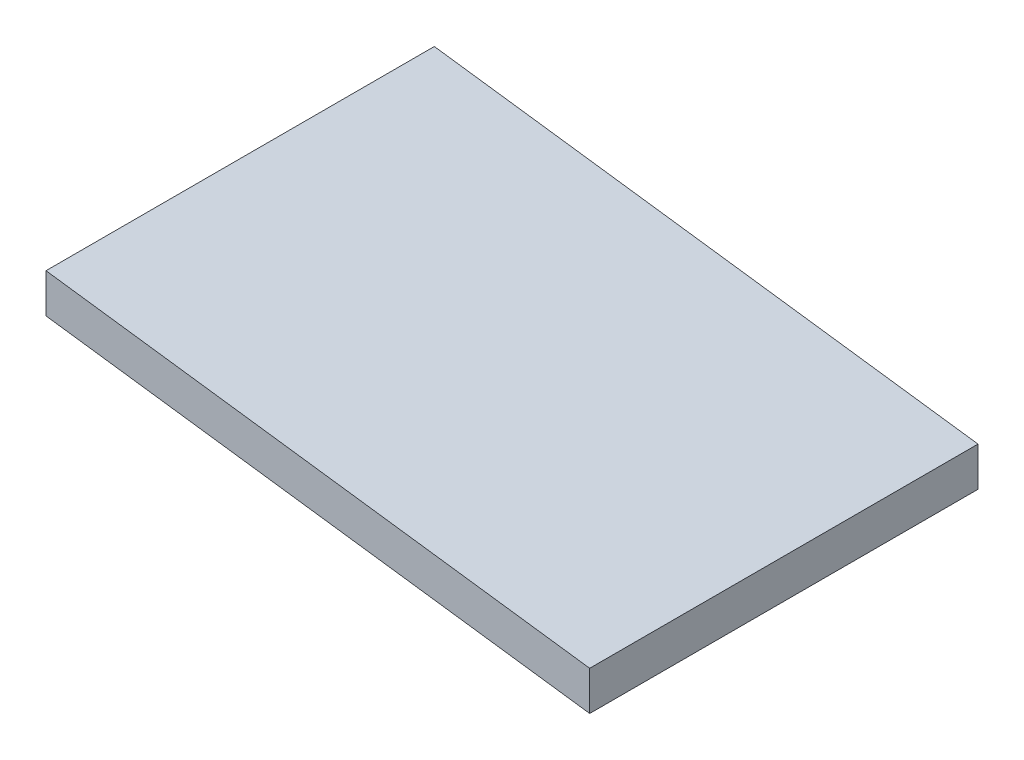
from build123d import *

# Parameters (mm, degrees)
BOSS_EXTRUDE1_DEPTH = 100


with BuildPart() as part:
    # Sketch1 → Boss-Extrude1 (new body)
    with BuildSketch(Plane.XY):
        Polygon((0, 0), (140, -18.666666667), (140, -28.755163967), (0, -10.0884973), align=None)
    extrude(amount=BOSS_EXTRUDE1_DEPTH)


solid = part.part
